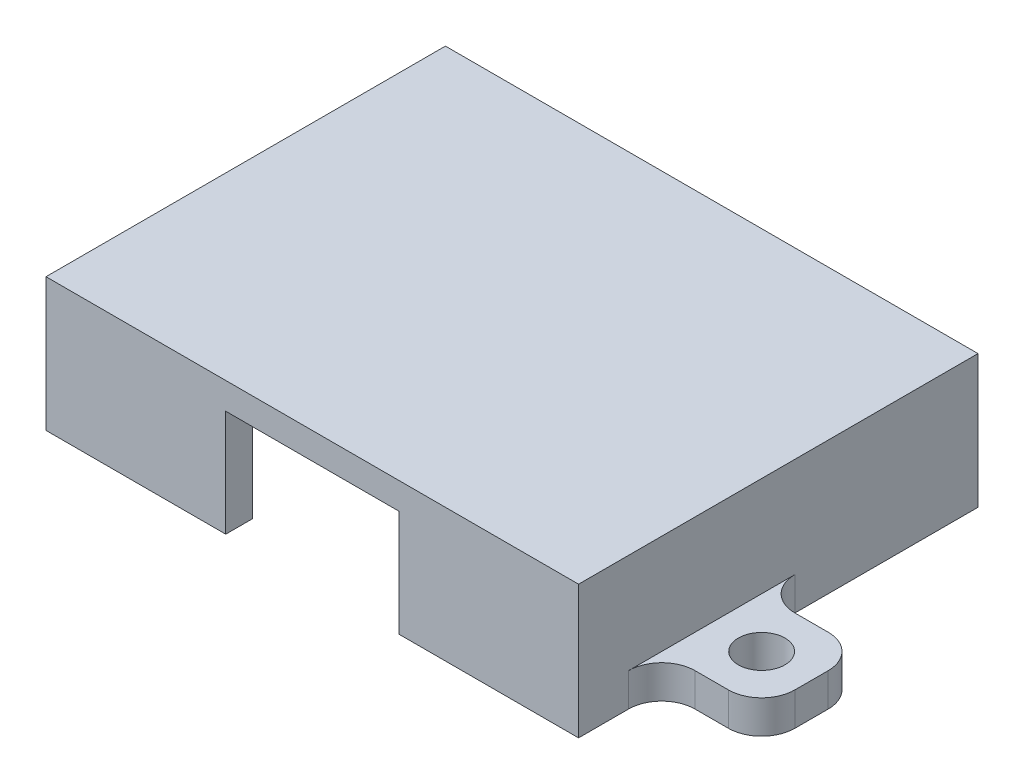
from build123d import *

# Parameters (mm, degrees)
SKETCH1_W           = 40
SKETCH1_H           = 30
BOSS_EXTRUDE1_DEPTH = 10
CUT_EXTRUDE1_DEPTH  = 8
SKETCH3_W           = 7.5
SKETCH3_H           = 2.5
BOSS_EXTRUDE2_DEPTH = 7.5
SKETCH4_R           = 1.75
CUT_EXTRUDE2_DEPTH  = 51.55937104
FILLET1_R           = 2.5
FILLET2_R           = 2.5


with BuildPart() as part:
    # Sketch1 → Boss-Extrude1 (new body)
    with BuildSketch(Plane(origin=(0, 0, 0), x_dir=(1, 0, 0), z_dir=(0, 1, 0))):
        with Locations((20, 15)):
            Rectangle(SKETCH1_W, SKETCH1_H)
    extrude(amount=BOSS_EXTRUDE1_DEPTH)

    # Sketch2 → Cut-Extrude1 (cut)
    with BuildSketch(Plane.XZ):
        Polygon((13.5, 0), (26.5, 0), (26.5, -2), (38, -2), (38, -28), (38, -30), (32, -30), (32, -28), (8, -28), (8, -30), (2, -30), (2, -28), (2, -2), (13.5, -2), align=None)
    extrude(amount=-CUT_EXTRUDE1_DEPTH, mode=Mode.SUBTRACT)

    # Sketch3 → Boss-Extrude2 (add)
    with BuildSketch(Plane.ZY):
        with Locations((-10, 1.25)):
            Rectangle(SKETCH3_W, SKETCH3_H)
    boss_extrude2 = extrude(amount=BOSS_EXTRUDE2_DEPTH)

    # Sketch4 → Cut-Extrude2 (cut, through all)
    with BuildSketch(Plane(origin=(0, 2.5, 0), x_dir=(1, 0, 0), z_dir=(0, 1, 0))):
        with Locations(Location((-3.75, 10, 0), (0, 0, 270))):
            Circle(SKETCH4_R)
    cut_extrude2 = extrude(amount=-CUT_EXTRUDE2_DEPTH, mode=Mode.SUBTRACT)

    # Fillet1
    fillet1_edges = [part.edges().sort_by_distance(p)[0] for p in [
        (0, 1.25, -6.25),
        (0, 1.25, -13.75),
        (-7.5, 1.25, -6.25),
        (-7.5, 1.25, -13.75),
    ]]
    fillet(fillet1_edges, radius=FILLET1_R)

    # Mirror1: Boss-Extrude2, Cut-Extrude2 across plane
    add(boss_extrude2.mirror(Plane.ZY.offset(-20)))
    add(cut_extrude2.mirror(Plane.ZY.offset(-20)), mode=Mode.SUBTRACT)

    # Fillet2
    fillet2_edges = [part.edges().sort_by_distance(p)[0] for p in [
        (47.5, 1.25, -6.25),
        (47.5, 1.25, -13.75),
        (40, 1.25, -6.25),
        (40, 1.25, -13.75),
    ]]
    fillet(fillet2_edges, radius=FILLET2_R)


solid = part.part
